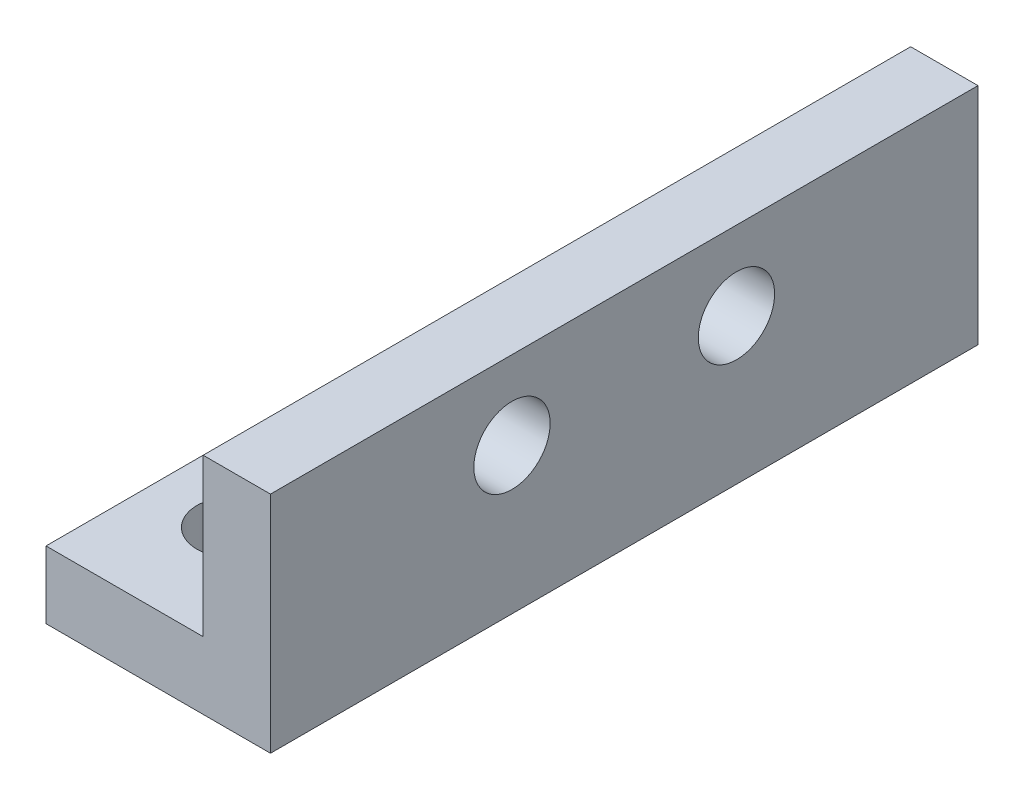
from build123d import *

# Parameters (mm, degrees)
EXTRUDE_1_DEPTH    = 31.52
HOLE_WIZARD_M3_1_D = 3.4
HOLE_WIZARD_M3_2_D = 3.4


with BuildPart() as part:
    # ｽｹｯﾁ1 → ﾎﾞｽ - 押し出し1 (new body)
    with BuildSketch(Plane.XY):
        Polygon((-5, -2), (2, -2), (2, 5), (5, 5), (5, -5), (-5, -5), align=None)
    extrude(amount=EXTRUDE_1_DEPTH)

    # M3 すきま穴1 (through all)
    with Locations(Plane(origin=(0, -2, 0), x_dir=(1, 0, 0), z_dir=(0, 1, 0))):
        with Locations((-1.5, -4.935), (-1.5, -26.585)):
            Hole(HOLE_WIZARD_M3_1_D / 2)

    # M3 すきま穴2 (through all)
    with Locations(Plane.ZY.offset(-2)):
        with Locations((10.76, 1.5), (20.76, 1.5)):
            Hole(HOLE_WIZARD_M3_2_D / 2)


solid = part.part
